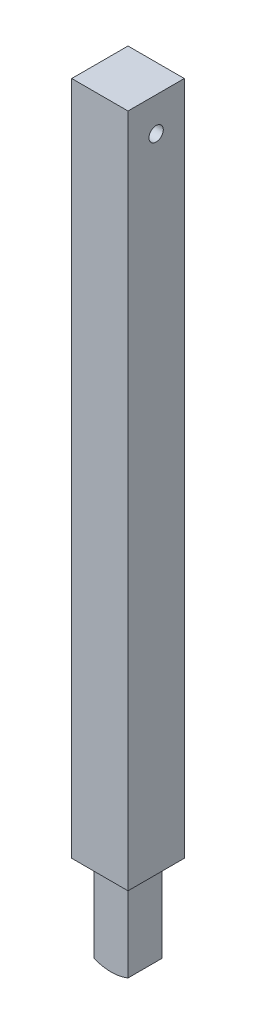
from build123d import *

# Parameters (mm, degrees)
SKETCH1_W                   = 15
SKETCH1_H                   = 15
BOSS_EXTRUDE1_DEPTH         = 40
CUT_EXTRUDE1_DEPTH          = 44.373378932
SKETCH3_W                   = 25
SKETCH3_H                   = 25
BOSS_EXTRUDE2_DEPTH         = 300
F_1_4_0_25_DIAMETER_HOLE1_D = 6.35


with BuildPart() as part:
    # Sketch1 → Boss-Extrude1 (new body)
    with BuildSketch(Plane(origin=(0, 0, 0), x_dir=(1, 0, 0), z_dir=(0, 1, 0))):
        Rectangle(SKETCH1_W, SKETCH1_H)
    extrude(amount=BOSS_EXTRUDE1_DEPTH)

    # Sketch2 → Cut-Extrude1 (cut, through all)
    with BuildSketch(Plane.XY.offset(7.5)):
        with BuildLine():
            ThreePointArc((1.6e-07, 0), (-3.820345171, 0.368266435), (-7.5, 1.459503782))
            Line((-7.5, 1.459503782), (-7.5, 0))
            Line((-7.5, 0), (1.6e-07, 0))
        make_face()
        with BuildLine():
            ThreePointArc((7.5, 1.459503782), (3.820345328, 0.368266465), (1.6e-07, 0))
            Line((1.6e-07, 0), (7.5, 0))
            Line((7.5, 0), (7.5, 1.459503782))
        make_face()
    extrude(amount=-CUT_EXTRUDE1_DEPTH, mode=Mode.SUBTRACT)

    # Sketch3 → Boss-Extrude2 (add)
    with BuildSketch(Plane(origin=(0, 40, 0), x_dir=(1, 0, 0), z_dir=(0, 1, 0))):
        Rectangle(SKETCH3_W, SKETCH3_H)
    extrude(amount=BOSS_EXTRUDE2_DEPTH)

    # 1/4 (0.25) Diameter Hole1 (through all)
    with Locations(Plane(origin=(12.5, 0, 0), x_dir=(0, 0, -1), z_dir=(1, 0, 0))):
        with Locations((0, 325)):
            Hole(F_1_4_0_25_DIAMETER_HOLE1_D / 2)


solid = part.part
